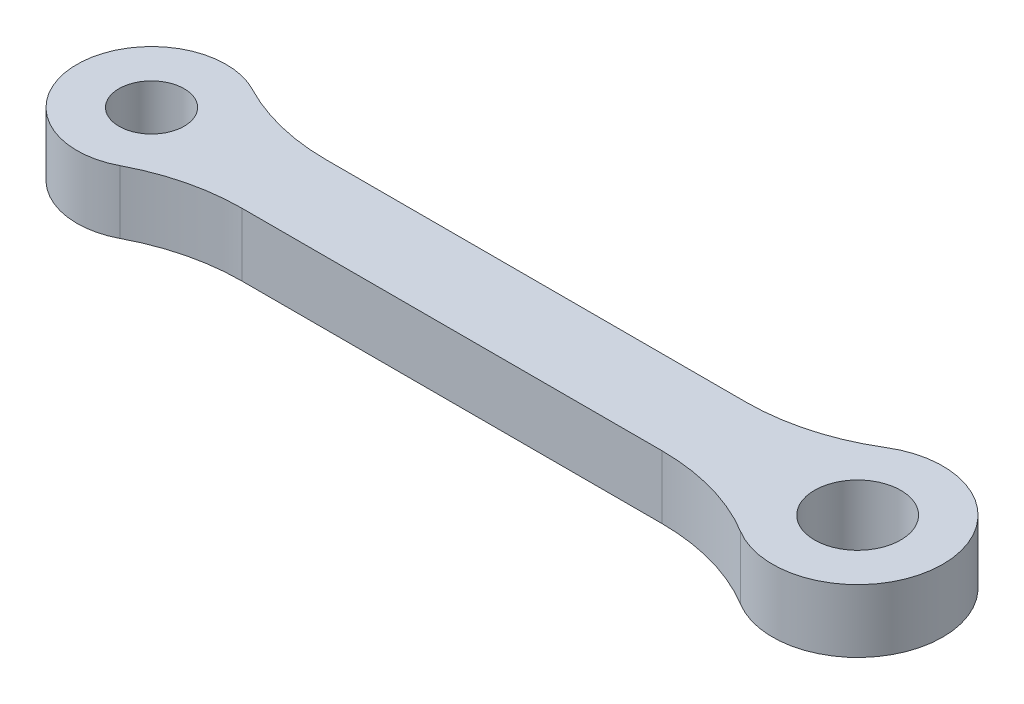
from build123d import *

# Parameters (mm, degrees)
SKETCH1_R           = 2.05
SKETCH1_R_2         = 1.55
BOSS_EXTRUDE1_DEPTH = 3
FILLET1_R           = 10


with BuildPart() as part:
    # Sketch1 → Boss-Extrude1 (new body)
    with BuildSketch(Plane(origin=(0, 0, 0), x_dir=(1, 0, 0), z_dir=(0, 1, 0))):
        with BuildLine():
            Line((-3.521718331, 2), (-30.646998125, 2))
            ThreePointArc((-30.646998125, 2), (-37.13, 0), (-30.646998125, -2))
            Line((-30.646998125, -2), (-3.521718331, -2))
            ThreePointArc((-3.521718331, -2), (4.05, 0), (-3.521718331, 2))
        make_face()
        with Locations(Location((0, 0, 0), (0, 0, 270))):
            Circle(SKETCH1_R, mode=Mode.SUBTRACT)
        with Locations(Location((-33.58, 0, 0), (0, 0, 270))):
            Circle(SKETCH1_R_2, mode=Mode.SUBTRACT)
    extrude(amount=BOSS_EXTRUDE1_DEPTH)

    # Fillet1
    fillet1_edges = [part.edges().sort_by_distance(p)[0] for p in [
        (-3.521718331, 1.5, 2),
        (-30.646998125, 1.5, 2),
        (-30.646998125, 1.5, -2),
        (-3.521718331, 1.5, -2),
    ]]
    fillet(fillet1_edges, radius=FILLET1_R)


solid = part.part
